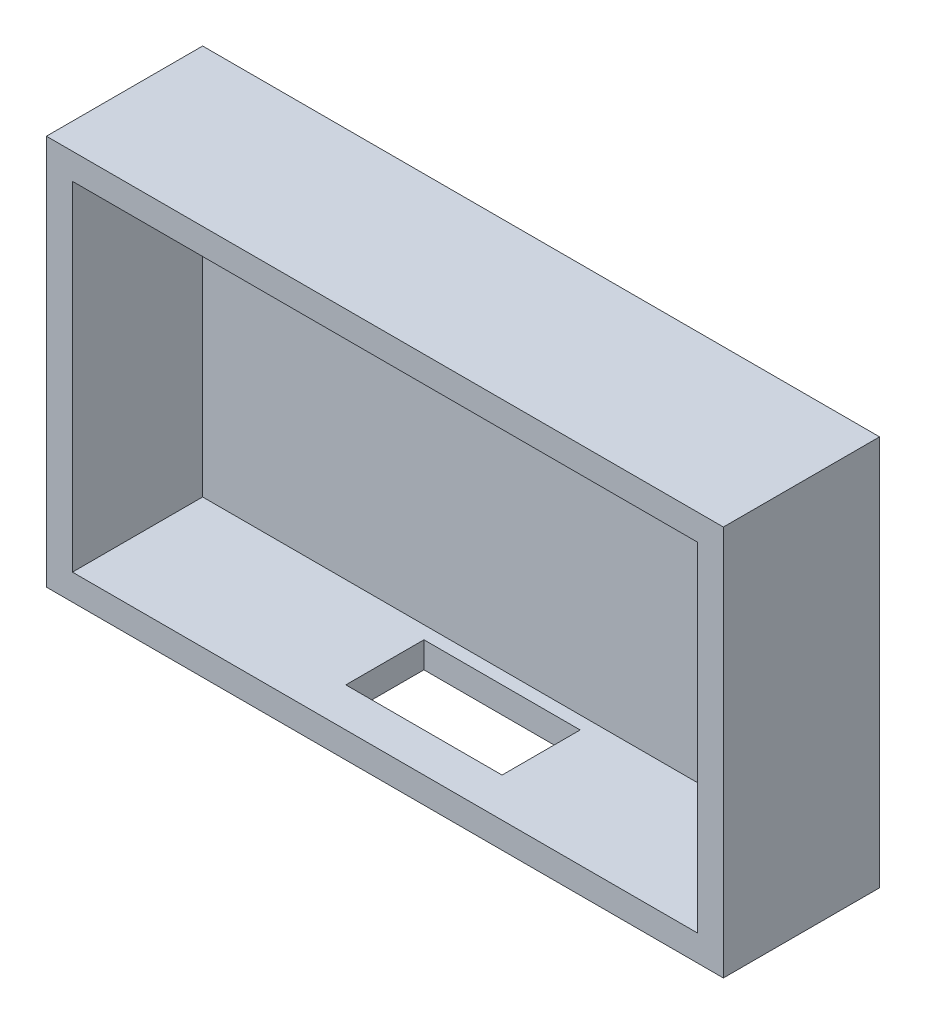
from build123d import *

# Parameters (mm, degrees)
SKETCH1_W           = 130
SKETCH1_H           = 30
BOSS_EXTRUDE1_DEPTH = 75
SHELL1_T            = -5
CUT_EXTRUDE1_REACH  = 155.052
SKETCH2_W           = 30
SKETCH2_H           = 15


with BuildPart() as part:
    # Sketch1 → Boss-Extrude1 (new body)
    with BuildSketch(Plane(origin=(0, 0, 0), x_dir=(1, 0, 0), z_dir=(0, 1, 0))):
        with Locations((65, 15)):
            Rectangle(SKETCH1_W, SKETCH1_H)
    extrude(amount=BOSS_EXTRUDE1_DEPTH)

    # Shell1
    shell1_openings = [part.faces().sort_by_distance(p)[0] for p in [
        (65, 37.5, 0),
    ]]
    offset(amount=SHELL1_T, openings=shell1_openings, kind=Kind.INTERSECTION)

    # Sketch2 → Cut-Extrude1 (cut, up to next)
    with BuildSketch(Plane.XZ, mode=Mode.PRIVATE) as cut_extrude1_sk1:
        with Locations((65, -15)):
            Rectangle(SKETCH2_W, SKETCH2_H)
    cut_extrude1_tool1 = extrude(cut_extrude1_sk1.sketch, amount=-CUT_EXTRUDE1_REACH, mode=Mode.PRIVATE) & part.part
    add(cut_extrude1_tool1.solids().sort_by_distance((65, 0, -15))[0], mode=Mode.SUBTRACT)


solid = part.part
